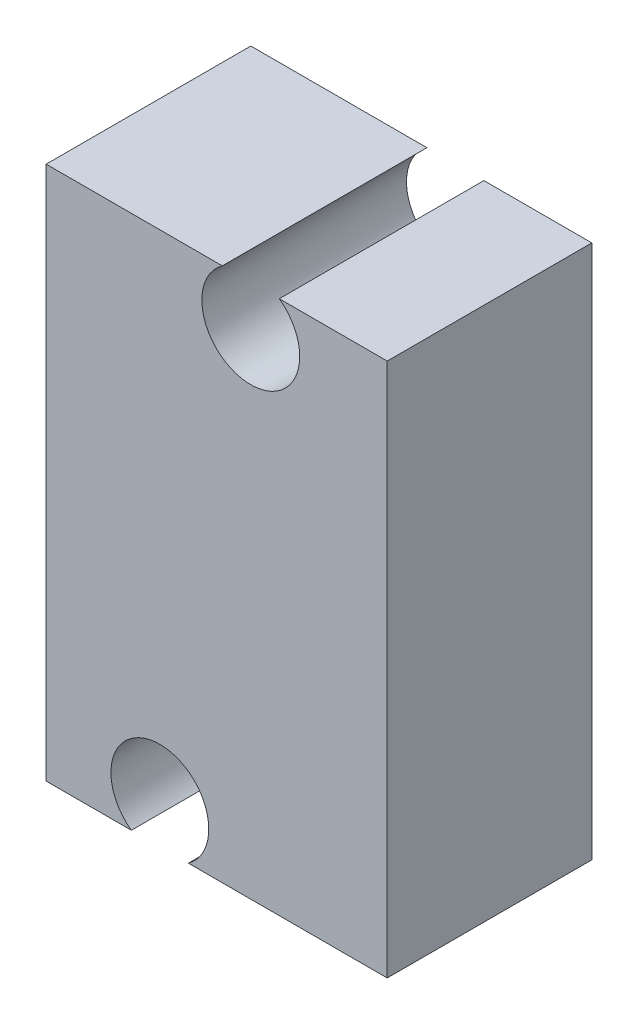
from build123d import *

# Parameters (mm, degrees)
SKETCH1_W           = 19.05
SKETCH1_H           = 29.845
BOSS_EXTRUDE1_DEPTH = 11.43
SKETCH2_R           = 2.733279887
CUT_EXTRUDE1_DEPTH  = 11.43


with BuildPart() as part:
    # Sketch1 → Boss-Extrude1 (new body)
    with BuildSketch(Plane.XY):
        with Locations((0.407051282, -4.094935897)):
            Rectangle(SKETCH1_W, SKETCH1_H)
    extrude(amount=BOSS_EXTRUDE1_DEPTH)

    # Sketch2 → Cut-Extrude1 (cut)
    with BuildSketch(Plane.XY.offset(11.43)):
        with Locations((2.312051282, 8.605064103)):
            Circle(SKETCH2_R)
        with Locations((-2.767948718, -16.794935897)):
            Circle(SKETCH2_R)
    extrude(amount=-CUT_EXTRUDE1_DEPTH, mode=Mode.SUBTRACT)


solid = part.part
